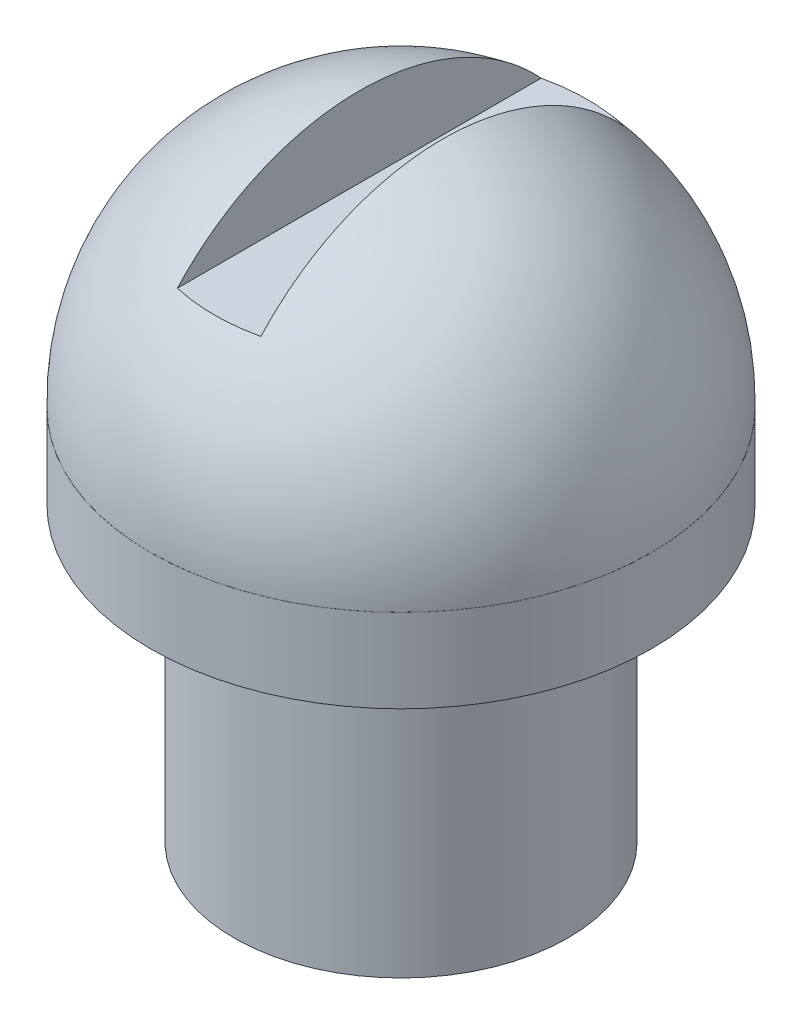
from build123d import *

# Parameters (mm, degrees)
SKETCH2_W          = 2
SKETCH2_H          = 4
CUT_EXTRUDE1_DEPTH = 5


with BuildPart() as part:
    # Sketch1 → Revolve1 (revolve)
    with BuildSketch(Plane.XY):
        with BuildLine():
            Line((6, 10.406467745), (5.997713172, 10.406467745))
            ThreePointArc((5.997713172, 10.406467745), (4.300804682, 14.755776187), (0, 16.572108049))
            Line((0, 16.572108049), (0, 0.406467745))
            Line((0, 0.406467745), (2, 0.406467745))
            Line((2, 0.406467745), (2, 1.406467745))
            Line((2, 1.406467745), (4, 1.406467745))
            Line((4, 1.406467745), (4, 8.406467745))
            Line((4, 8.406467745), (6, 8.406467745))
            Line((6, 8.406467745), (6, 10.406467745))
        make_face()
    revolve(axis=Axis((0, 0.406467745, 0), (0, 1, 0)))

    # Sketch2 → Cut-Extrude1 (cut, symmetric)
    with BuildSketch(Plane.XY):
        with Locations((0, 16.572108049)):
            Rectangle(SKETCH2_W, SKETCH2_H)
    extrude(amount=CUT_EXTRUDE1_DEPTH, both=True, mode=Mode.SUBTRACT)


solid = part.part
